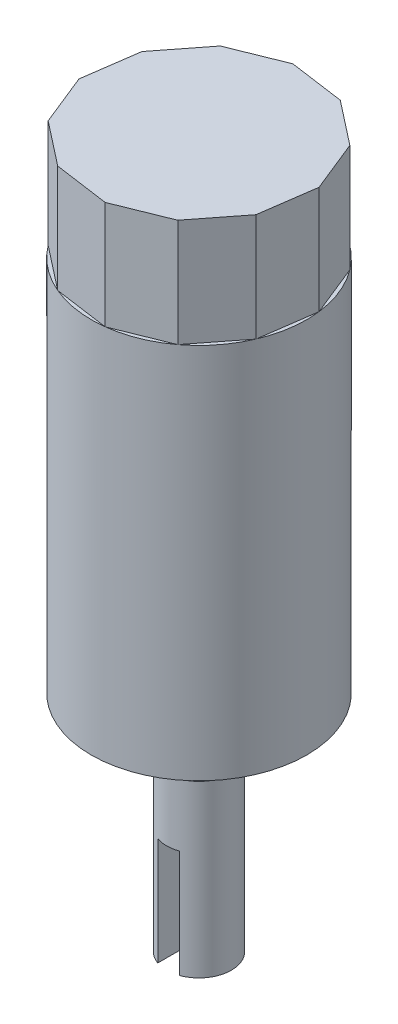
from build123d import *

# Parameters (mm, degrees)
SKETCH_1_R          = 1.5
EXTRUDE_1_DEPTH     = 7.9
CUT_EXTRUDE_1_DEPTH = 5
SKETCH_3_R          = 1
EXTRUDE_2_DEPTH     = 2.5
SKETCH_4_R          = 5
EXTRUDE_3_DEPTH     = 22.5
CUT_EXTRUDE_START   = -5
CUT_EXTRUDE_3_DEPTH = 5


with BuildPart() as part:
    # 草图1 → 凸台-拉伸1 (new body)
    with BuildSketch(Plane(origin=(0, 0, 0), x_dir=(1, 0, 0), z_dir=(0, 1, 0))):
        with Locations(Location((0, 0, 0), (0, 0, 270))):
            Circle(SKETCH_1_R)
    extrude(amount=EXTRUDE_1_DEPTH)

    # 草图2 → 切除-拉伸1 (cut)
    with BuildSketch(Plane.XZ):
        with BuildLine():
            Line((-0.5, 1.414213562), (-0.5, -1.414213562))
            ThreePointArc((-0.5, -1.414213562), (0, -1.5), (0.5, -1.414213562))
            Line((0.5, -1.414213562), (0.5, 1.414213562))
            ThreePointArc((0.5, 1.414213562), (0, 1.5), (-0.5, 1.414213562))
        make_face()
    extrude(amount=-CUT_EXTRUDE_1_DEPTH, mode=Mode.SUBTRACT)

    # 草图3 → 凸台-拉伸2 (add)
    with BuildSketch(Plane(origin=(0, 7.9, 0), x_dir=(1, 0, 0), z_dir=(0, 1, 0))):
        with Locations(Location((0, 0, 0), (0, 0, 270))):
            Circle(SKETCH_3_R)
    extrude(amount=EXTRUDE_2_DEPTH)

    # 草图4 → 凸台-拉伸3 (add)
    with BuildSketch(Plane(origin=(0, 10.4, 0), x_dir=(1, 0, 0), z_dir=(0, 1, 0))):
        with Locations(Location((0, 0, 0), (0, 0, 90))):
            Circle(SKETCH_4_R)
    extrude(amount=EXTRUDE_3_DEPTH)

    # 草图5 → 切除-拉伸3 (cut)
    with BuildSketch(Plane(origin=(0, 32.9, 0), x_dir=(1, 0, 0), z_dir=(0, 1, 0)).offset(CUT_EXTRUDE_START)):
        with BuildLine():
            ThreePointArc((-1.954985899, -4.60195938), (-0.697296637, -4.951139), (0.607912238, -4.96290668))
            Line((0.607912238, -4.96290668), (-1.954985899, -4.60195938))
        make_face()
        with BuildLine():
            ThreePointArc((0.607912238, -4.96290668), (1.871692898, -4.63646047), (3.007920781, -3.994047142))
            Line((3.007920781, -3.994047142), (0.607912238, -4.96290668))
        make_face()
        with BuildLine():
            ThreePointArc((3.007920781, -3.994047142), (3.939163833, -3.079446102), (4.60195938, -1.954985899))
            Line((4.60195938, -1.954985899), (3.007920781, -3.994047142))
        make_face()
        with BuildLine():
            ThreePointArc((5, 0), (4.990718054, 0.304521429), (4.96290668, 0.607912238))
            Line((4.96290668, 0.607912238), (4.60195938, -1.954985899))
            ThreePointArc((4.60195938, -1.954985899), (4.899479406, -0.997547768), (5, 0))
        make_face()
        with BuildLine():
            ThreePointArc((4.96290668, 0.607912238), (4.63646047, 1.871692898), (3.994047142, 3.007920781))
            Line((3.994047142, 3.007920781), (4.96290668, 0.607912238))
        make_face()
        with BuildLine():
            Line((-1.954985899, -4.60195938), (-3.994047142, -3.007920781))
            ThreePointArc((-3.994047142, -3.007920781), (-3.079446102, -3.939163833), (-1.954985899, -4.60195938))
        make_face()
        with BuildLine():
            Line((-3.994047142, -3.007920781), (-4.96290668, -0.607912238))
            ThreePointArc((-4.96290668, -0.607912238), (-4.63646047, -1.871692898), (-3.994047142, -3.007920781))
        make_face()
        with BuildLine():
            Line((-4.96290668, -0.607912238), (-4.60195938, 1.954985899))
            ThreePointArc((-4.60195938, 1.954985899), (-4.951139, 0.697296637), (-4.96290668, -0.607912238))
        make_face()
        with BuildLine():
            Line((-4.60195938, 1.954985899), (-3.007920781, 3.994047142))
            ThreePointArc((-3.007920781, 3.994047142), (-3.939163833, 3.079446102), (-4.60195938, 1.954985899))
        make_face()
        with BuildLine():
            Line((-3.007920781, 3.994047142), (-0.607912238, 4.96290668))
            ThreePointArc((-0.607912238, 4.96290668), (-1.871692898, 4.63646047), (-3.007920781, 3.994047142))
        make_face()
        with BuildLine():
            Line((-0.607912238, 4.96290668), (1.954985899, 4.60195938))
            ThreePointArc((1.954985899, 4.60195938), (0.697296637, 4.951139), (-0.607912238, 4.96290668))
        make_face()
        with BuildLine():
            ThreePointArc((3.994047142, 3.007920781), (3.079446102, 3.939163833), (1.954985899, 4.60195938))
            Line((1.954985899, 4.60195938), (3.994047142, 3.007920781))
        make_face()
    extrude(amount=CUT_EXTRUDE_3_DEPTH, mode=Mode.SUBTRACT)


solid = part.part
